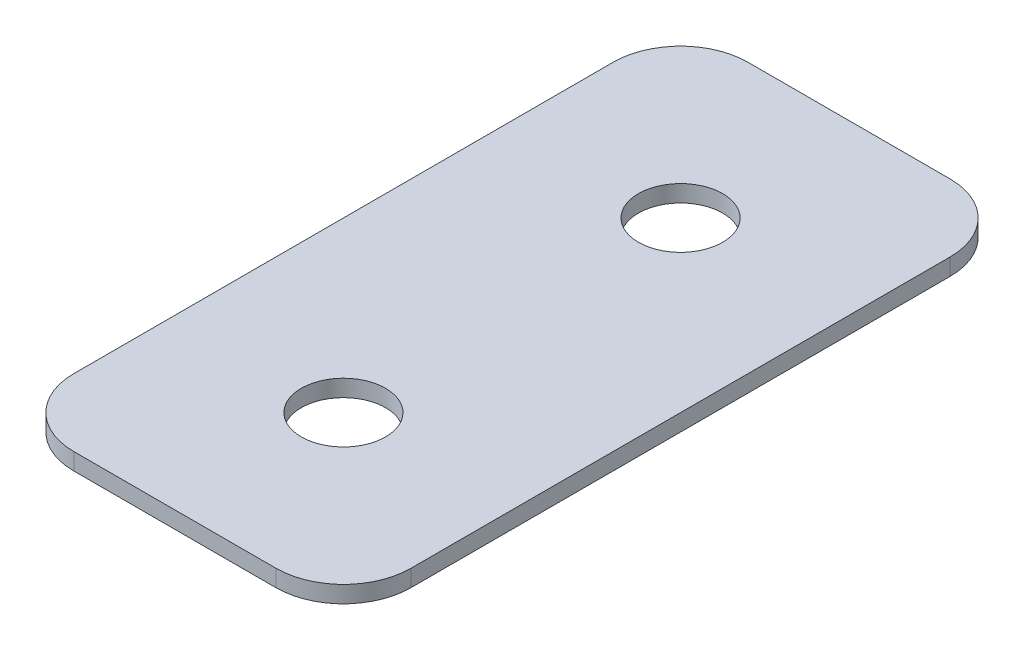
from build123d import *

# Parameters (mm, degrees)
SKETCH_1_R      = 2.5
EXTRUDE_2_DEPTH = 1


with BuildPart() as part:
    # 草图1 → 凸台-拉伸2 (new body)
    with BuildSketch(Plane(origin=(0, 0, 0), x_dir=(1, 0, 0), z_dir=(0, 1, 0))):
        with BuildLine():
            Line((-4, 0), (-16, 0))
            ThreePointArc((-16, 0), (-18.828427125, 1.171572875), (-20, 4))
            Line((-20, 4), (-20, 36))
            ThreePointArc((-20, 36), (-18.828427125, 38.828427125), (-16, 40))
            Line((-16, 40), (-4, 40))
            ThreePointArc((-4, 40), (-1.171572875, 38.828427125), (0, 36))
            Line((0, 36), (0, 4))
            ThreePointArc((0, 4), (-1.171572875, 1.171572875), (-4, 0))
        make_face()
        with Locations(Location((-10, 10, 0), (0, 0, 270))):
            Circle(SKETCH_1_R, mode=Mode.SUBTRACT)
        with Locations(Location((-10, 30, 0), (0, 0, 270))):
            Circle(SKETCH_1_R, mode=Mode.SUBTRACT)
    extrude(amount=EXTRUDE_2_DEPTH)


solid = part.part
